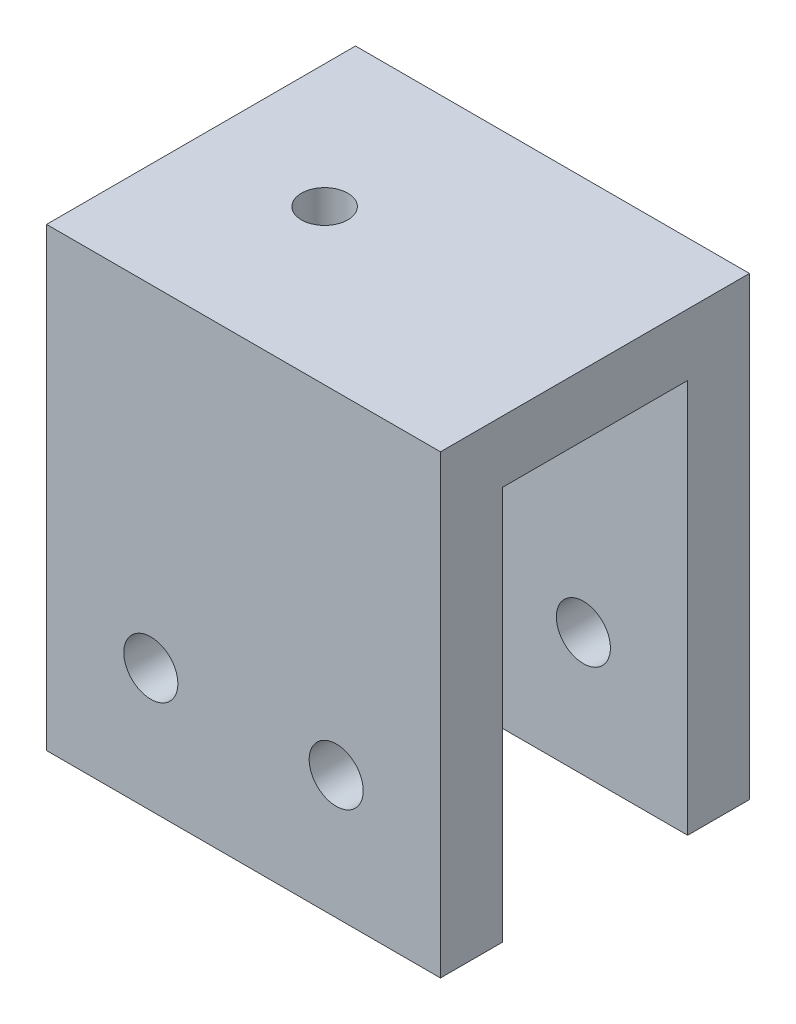
from build123d import *

# Parameters (mm, degrees)
SKETCH1_W             = 12.75
SKETCH1_H             = 12.75
BOSS_EXTRUDE1_DEPTH   = 2
SKETCH2_W             = 12.75
SKETCH2_H             = 12.75
BOSS_EXTRUDE2_DEPTH   = 2
SKETCH3_W             = 12.75
SKETCH3_H             = 10
BOSS_EXTRUDE3_DEPTH   = 2
F_1_0MM_DOWEL_HOLE1_D = 1.75
F_1_0MM_DOWEL_HOLE2_D = 1.5


with BuildPart() as part:
    # Sketch1 → Boss-Extrude1 (new body)
    with BuildSketch(Plane.XY):
        with Locations((-6.375, 6.375)):
            Rectangle(SKETCH1_W, SKETCH1_H)
    extrude(amount=BOSS_EXTRUDE1_DEPTH)



with BuildPart() as body_2:
    # Sketch2 → Boss-Extrude2 (new body)
    with BuildSketch(Plane(origin=(0, 0, -6), x_dir=(-1, 0, 0), z_dir=(0, 0, -1))):
        with Locations((6.375, 6.375)):
            Rectangle(SKETCH2_W, SKETCH2_H)
    extrude(amount=BOSS_EXTRUDE2_DEPTH)


with BuildPart() as part_1:
    add(part.part)

    add(body_2.part)  # Boss-Extrude3 merges body 2
    # Sketch3 → Boss-Extrude3 (add)
    with BuildSketch(Plane(origin=(0, 12.75, 0), x_dir=(1, 0, 0), z_dir=(0, 1, 0))):
        with Locations((-6.375, 3)):
            Rectangle(SKETCH3_W, SKETCH3_H)
    extrude(amount=BOSS_EXTRUDE3_DEPTH)

    # Ø1.0mm Dowel Hole1 (through all)
    with Locations(Plane.XY.offset(2)):
        with Locations((-9.375, 4), (-3.375, 4)):
            Hole(F_1_0MM_DOWEL_HOLE1_D / 2)

    # Ø1.0mm Dowel Hole2 (through all)
    with Locations(Plane(origin=(0, 14.75, 0), x_dir=(1, 0, 0), z_dir=(0, 1, 0))):
        with Locations((-8.75, 3)):
            Hole(F_1_0MM_DOWEL_HOLE2_D / 2)


solid = part_1.part
